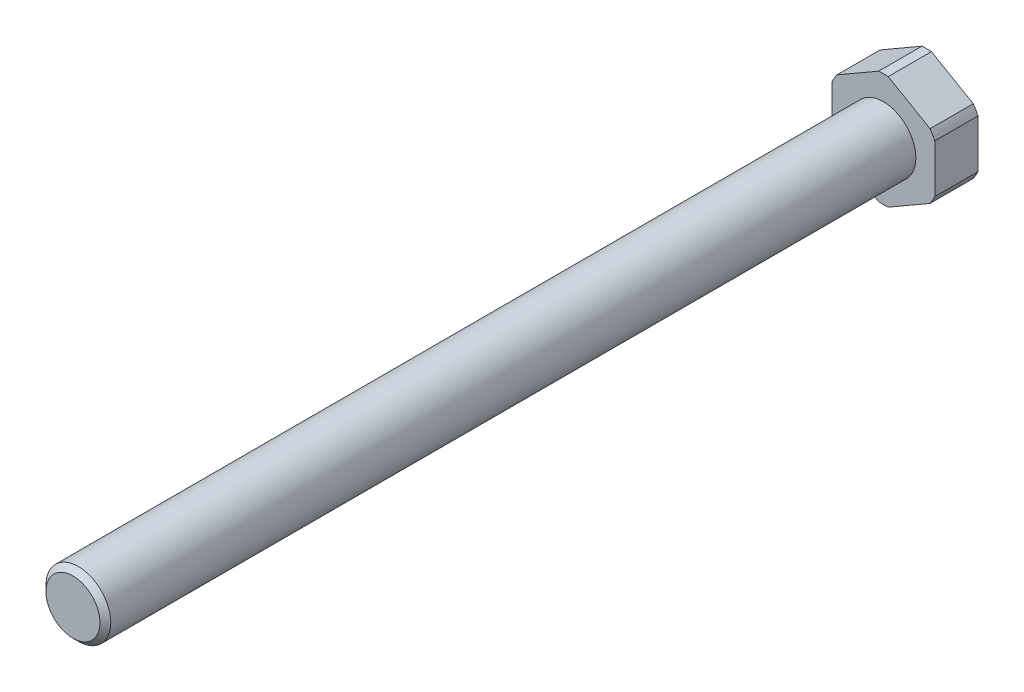
from build123d import *

# Parameters (mm, degrees)
SKETCH_1_R               = 10.5
EXTRUDE_226_DEPTH        = 8
CUT_EXTRUDE_1_DEPTH      = 17.867127793
PATTERN_CIRCULAR_1_COUNT = 6
SKETCH_3_R               = 6
EXTRUDE_1_DEPTH          = 150
CHAMFER_1_SIZE           = 1


with BuildPart() as part:
    # Эскиз1 → Extrude 226 (new body)
    with BuildSketch(Plane.XY):
        Circle(SKETCH_1_R)
    extrude(amount=EXTRUDE_226_DEPTH)

    # Эскиз2 → Вырез-Вытянуть1 (cut, through all)
    with BuildSketch(Plane.XY.offset(8)):
        with BuildLine():
            Line((-9.5, 4.472135955), (-9.5, -4.472135955))
            ThreePointArc((-9.5, -4.472135955), (-10.5, 0), (-9.5, 4.472135955))
        make_face()
    cut_extrude_1 = extrude(amount=-CUT_EXTRUDE_1_DEPTH, mode=Mode.SUBTRACT)

    # Круговой массив1: Вырез-Вытянуть1 ×6 about axis
    pattern_circular_1_axis = Axis((0, 0, 58), (0, 0, -1))
    for i in range(1, PATTERN_CIRCULAR_1_COUNT):
        add(cut_extrude_1.rotate(pattern_circular_1_axis, i * 360 / PATTERN_CIRCULAR_1_COUNT), mode=Mode.SUBTRACT)

    # Эскиз3 → Бобышка-Вытянуть1 (add)
    with BuildSketch(Plane.XY.offset(8)):
        Circle(SKETCH_3_R)
    extrude(amount=EXTRUDE_1_DEPTH)

    # Фаска1
    chamfer_1_edges = [part.edges().sort_by_distance(p)[0] for p in [
        (-6, 0, 158),
    ]]
    chamfer(chamfer_1_edges, length=CHAMFER_1_SIZE)


solid = part.part
